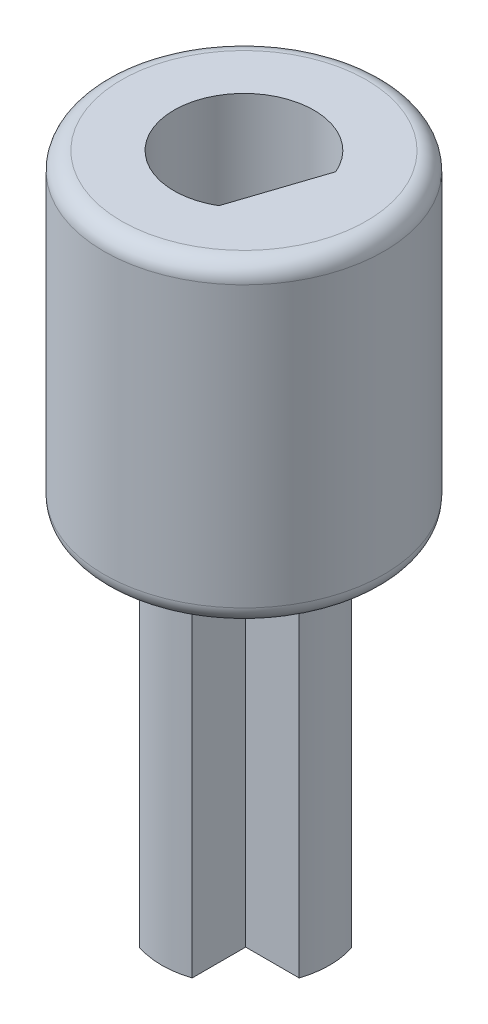
from build123d import *

# Parameters (mm, degrees)
RESSALTO_EXTRUS_O1_DEPTH = 10
ESBO_O7_R                = 4
RESSALTO_EXTRUS_O3_DEPTH = 9
CORTE_EXTRUS_O2_DEPTH    = 7.5
FILETE9_R                = 0.5


with BuildPart() as part:
    # Esboço1 → Ressalto-extrusão1 (new body)
    with BuildSketch(Plane(origin=(0, 0, 0), x_dir=(1, 0, 0), z_dir=(0, 1, 0))):
        with BuildLine():
            Line((-16.085684063, 12.227593462), (-17.615486686, 12.227593462))
            Line((-17.615486686, 12.227593462), (-17.615486686, 13.727593462))
            Line((-17.615486686, 13.727593462), (-17.615486686, 13.757396085))
            ThreePointArc((-17.615486686, 13.757396085), (-18.365486686, 13.877593462), (-19.115486686, 13.757396085))
            Line((-19.115486686, 13.757396085), (-19.115486686, 13.727593462))
            Line((-19.115486686, 13.727593462), (-19.115486686, 12.227593462))
            Line((-19.115486686, 12.227593462), (-20.615486686, 12.227593462))
            Line((-20.615486686, 12.227593462), (-20.645289309, 12.227593462))
            ThreePointArc((-20.645289309, 12.227593462), (-20.765486686, 11.477593462), (-20.645289309, 10.727593462))
            Line((-20.645289309, 10.727593462), (-20.615486686, 10.727593462))
            Line((-20.615486686, 10.727593462), (-19.115486686, 10.727593462))
            Line((-19.115486686, 10.727593462), (-19.115486686, 9.227593462))
            Line((-19.115486686, 9.227593462), (-19.115486686, 9.197790839))
            ThreePointArc((-19.115486686, 9.197790839), (-18.365486686, 9.077593462), (-17.615486686, 9.197790839))
            Line((-17.615486686, 9.197790839), (-17.615486686, 9.227593462))
            Line((-17.615486686, 9.227593462), (-17.615486686, 10.727593462))
            Line((-17.615486686, 10.727593462), (-16.085684063, 10.727593462))
            ThreePointArc((-16.085684063, 10.727593462), (-15.965486686, 11.477593462), (-16.085684063, 12.227593462))
        make_face()
    extrude(amount=RESSALTO_EXTRUS_O1_DEPTH)

    # Esboço7 → Ressalto-extrusão3 (add)
    with BuildSketch(Plane(origin=(0, 10, 0), x_dir=(1, 0, 0), z_dir=(0, 1, 0))):
        with Locations(Location((-18.365486686, 11.428442315, 0), (0, 0, 270))):
            Circle(ESBO_O7_R)
    extrude(amount=RESSALTO_EXTRUS_O3_DEPTH)

    # Esboço9 → Corte-extrusão2 (cut)
    with BuildSketch(Plane(origin=(0, 19, 0), x_dir=(1, 0, 0), z_dir=(0, 1, 0))):
        with BuildLine():
            Line((-17.35582754, 9.702004246), (-16.526382122, 12.214377685))
            ThreePointArc((-16.526382122, 12.214377685), (-20.264662492, 12.055444115), (-17.35582754, 9.702004246))
        make_face()
    extrude(amount=-CORTE_EXTRUS_O2_DEPTH, mode=Mode.SUBTRACT)

    # Filete9
    filete9_edges = [part.edges().sort_by_distance(p)[0] for p in [
        (-20.765486686, 10, -11.477593462),
        (-19.880387997, 10, -10.727593462),
        (-19.115486686, 10, -9.96269215),
        (-18.365486686, 10, -9.077593462),
        (-17.615486686, 10, -9.96269215),
        (-16.850585374, 10, -10.727593462),
        (-15.965486686, 10, -11.477593462),
        (-18.365486686, 10, -15.428442315),
        (-18.365486686, 19, -15.428442315),
        (-16.850585374, 10, -12.227593462),
        (-17.615486686, 10, -12.992494773),
        (-19.880387997, 10, -12.227593462),
        (-18.365486686, 10, -13.877593462),
        (-19.115486686, 10, -12.992494773),
    ]]
    fillet(filete9_edges, radius=FILETE9_R)


solid = part.part
